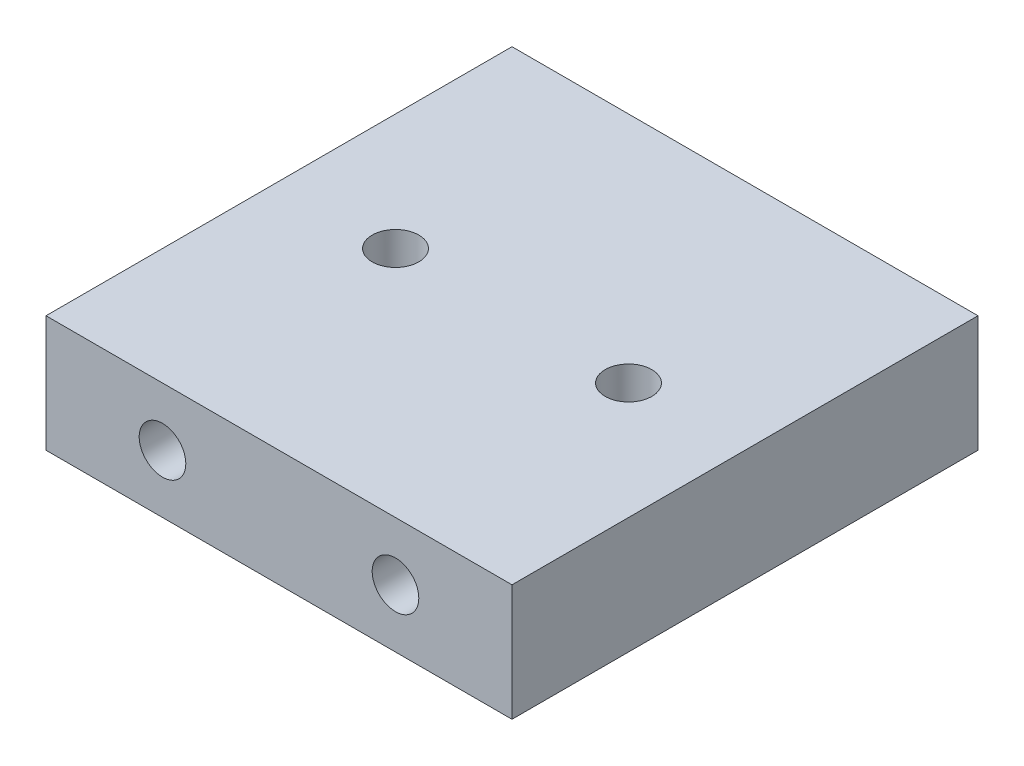
from build123d import *

# Parameters (mm, degrees)
SKETCH2_W           = 40
SKETCH2_H           = 40
BOSS_EXTRUDE1_DEPTH = 10
SKETCH3_R           = 2
CUT_EXTRUDE1_DEPTH  = 51
SKETCH4_R           = 2
CUT_EXTRUDE2_DEPTH  = 12


with BuildPart() as part:
    # Sketch2 → Boss-Extrude1 (new body)
    with BuildSketch(Plane(origin=(0, 0, 0), x_dir=(1, 0, 0), z_dir=(0, 1, 0))):
        Rectangle(SKETCH2_W, SKETCH2_H)
    extrude(amount=BOSS_EXTRUDE1_DEPTH)

    # Sketch3 → Cut-Extrude1 (cut)
    with BuildSketch(Plane.XY.offset(20)):
        with Locations((10, 5)):
            Circle(SKETCH3_R)
        with Locations((-10, 5)):
            Circle(SKETCH3_R)
    extrude(amount=-CUT_EXTRUDE1_DEPTH, mode=Mode.SUBTRACT)

    # Sketch4 → Cut-Extrude2 (cut)
    with BuildSketch(Plane.XZ):
        with Locations(Location((10, 0, 0), (0, 0, 270))):
            Circle(SKETCH4_R)
        with Locations(Location((-10, 0, 0), (0, 0, 270))):
            Circle(SKETCH4_R)
    extrude(amount=-CUT_EXTRUDE2_DEPTH, mode=Mode.SUBTRACT)


solid = part.part
